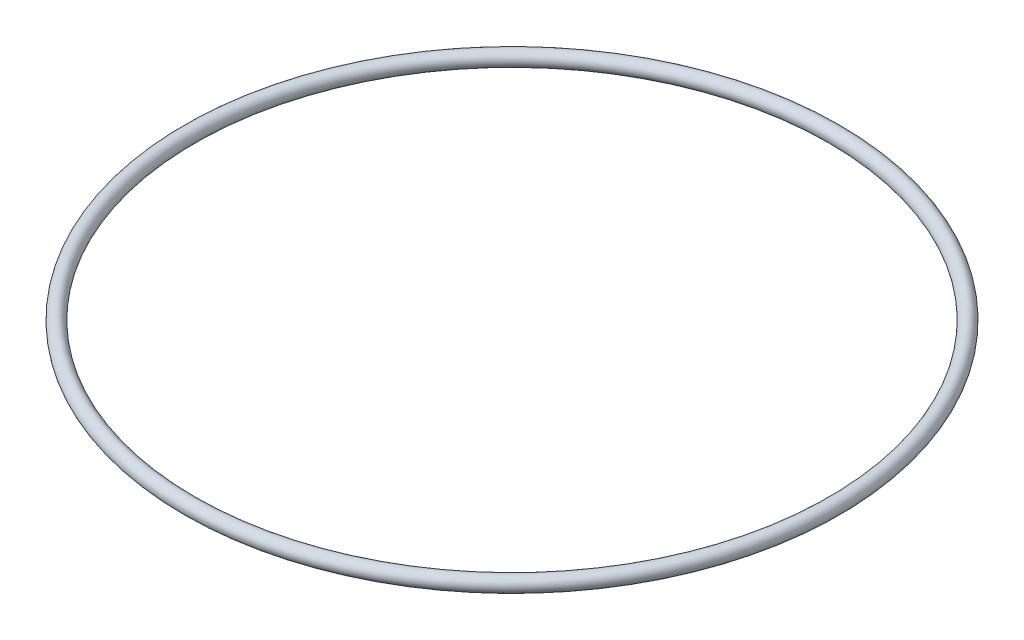
from build123d import *

# Parameters (mm, degrees)
SZKIC1_R = 1.5


with BuildPart() as part:
    # Szkic1 → Obrót1 (revolve)
    with BuildSketch(Plane.XY, mode=Mode.PRIVATE) as obr_t1_sk:
        with Locations((-65.5, 0)):
            Circle(SZKIC1_R)
    revolve(obr_t1_sk.sketch.rotate(Axis((0, 5.536808648, 0), (0, -1, 0)), 270), axis=Axis((0, 5.536808648, 0), (0, -1, 0)))


solid = part.part
